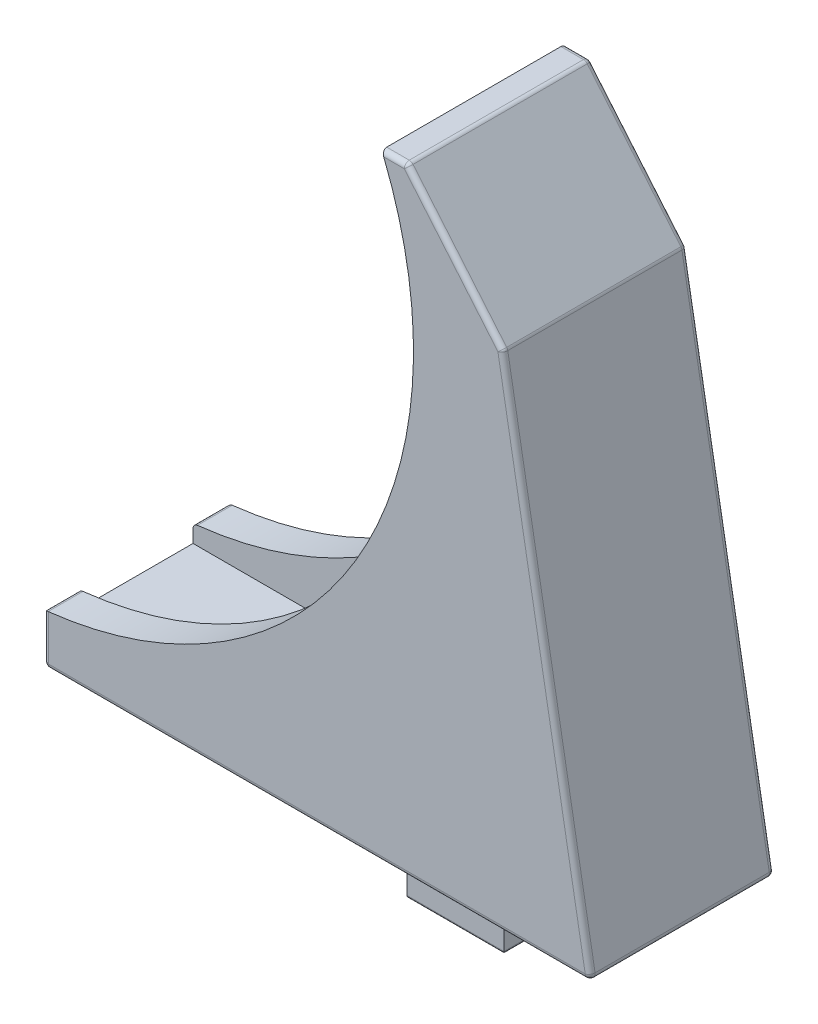
from build123d import *

# Parameters (mm, degrees)
EXTRUDE_1_DEPTH          = 2.3
EXTRUDE_1_DEPTH_BACK     = 2.3
EXTRUDE_2_DEPTH          = 1.4
EXTRUDE_3_DEPTH          = 2
EXTRUDE_3_DEPTH_BACK     = 2
CUT_EXTRUDE_2_DEPTH      = 7.4
CUT_EXTRUDE_3_DEPTH      = 2
CUT_EXTRUDE_3_DEPTH_BACK = 2
FILLET_1_R               = 0.2
FILLET_2_R               = 0.1


with BuildPart() as part:
    # 草图1 → 凸台-拉伸1 (new, two sides: drawn at the far end of the back side and taken through both)
    with BuildSketch(Plane.XY.offset(-EXTRUDE_1_DEPTH_BACK)):
        Polygon((0, 0), (-14.8, 0), (-14.8, 1.3), (0, 1.3), (5.65072033, 1.3), (2.420449835, 19.619774331), (-0.822713256, 23.484825595), (-1.2165133, 23.484825595), (-1.2165133, 24.784825595), (-0.2165133, 24.784825595), (3.640212358, 20.188558937), (7.2, 0), align=None)
    extrude(amount=EXTRUDE_1_DEPTH + EXTRUDE_1_DEPTH_BACK)

    # 草图2 → 凸台-拉伸2 (add)
    with BuildSketch(Plane.XY.offset(2.3)):
        with BuildLine():
            Line((-14.8, 0), (7.2, 0))
            Line((7.2, 0), (3.640212358, 20.188558937))
            Line((3.640212358, 20.188558937), (-0.2165133, 24.784825595))
            Line((-0.2165133, 24.784825595), (-1.2165133, 24.784825595))
            ThreePointArc((-1.2165133, 24.784825595), (-2.266370135, 9.969308294), (-14.8, 2))
            Line((-14.8, 2), (-14.8, 0))
        make_face()
    extrude_2 = extrude(amount=EXTRUDE_2_DEPTH)

    # 镜向1: 凸台-拉伸2 across plane
    add(extrude_2.mirror(Plane.XY))

    # 草图4 → 凸台-拉伸3 (add, two sides: drawn at the far end of the back side and taken through both)
    with BuildSketch(Plane.XY.offset(-EXTRUDE_3_DEPTH_BACK)):
        with BuildLine():
            Line((-1.5, 0), (1.5, 0))
            Line((1.5, 0), (1.5, -0.677124344))
            ThreePointArc((1.5, -0.677124344), (1.780042303, -1.088161527), (1.95, -1.555590279))
            Line((1.95, -1.555590279), (1.95, -2.5))
            Line((1.95, -2.5), (-1.95, -2.5))
            Line((-1.95, -2.5), (-1.95, -1.555590279))
            ThreePointArc((-1.95, -1.555590279), (-1.780042303, -1.088161527), (-1.5, -0.677124344))
            Line((-1.5, -0.677124344), (-1.5, 0))
        make_face()
    extrude(amount=EXTRUDE_3_DEPTH + EXTRUDE_3_DEPTH_BACK)

    # 草图5 → 切除-拉伸2 (cut)
    with BuildSketch(Plane.XY.offset(3.7)):
        with BuildLine():
            Line((-1.2165133, 24.784825595), (-14.8, 2))
            ThreePointArc((-14.8, 2), (-2.266370135, 9.969308294), (-1.2165133, 24.784825595))
        make_face()
    extrude(amount=-CUT_EXTRUDE_2_DEPTH, mode=Mode.SUBTRACT)

    # 草图6 → 切除-拉伸3 (cut, two sides: drawn at the far end of the back side and taken through both)
    with BuildSketch(Plane(origin=(0, 0, 0), x_dir=(0, 0, -1), z_dir=(1, 0, 0)).offset(-CUT_EXTRUDE_3_DEPTH_BACK)):
        with BuildLine():
            Line((1.5, 0), (1.5, -0.677124344))
            ThreePointArc((1.5, -0.677124344), (1.780042303, -1.088161527), (1.95, -1.555590279))
            Line((1.95, -1.555590279), (1.95, -2.5))
            Line((1.95, -2.5), (2, -2.5))
            Line((2, -2.5), (2, 0))
            Line((2, 0), (1.5, 0))
        make_face()
        with BuildLine():
            Line((-1.95, -2.5), (-2, -2.5))
            Line((-2, -2.5), (-2, 0))
            Line((-2, 0), (-1.5, 0))
            Line((-1.5, 0), (-1.5, -0.677124344))
            ThreePointArc((-1.5, -0.677124344), (-1.780042303, -1.088161527), (-1.95, -1.555590279))
            Line((-1.95, -1.555590279), (-1.95, -2.5))
        make_face()
    extrude(amount=CUT_EXTRUDE_3_DEPTH + CUT_EXTRUDE_3_DEPTH_BACK, mode=Mode.SUBTRACT)

    # 圆角1
    fillet_1_edges = [part.edges().sort_by_distance(p)[0] for p in [
        (-14.8, 2, -3),
        (-14.8, 2, 3),
        (-14.8, 1, 3.7),
        (-14.8, 1, -3.7),
        (-0.7165133, 24.784825595, -3.7),
        (-0.7165133, 24.784825595, 3.7),
        (-0.2165133, 24.784825595, 0),
        (1.711849529, 22.486692266, -3.7),
        (1.711849529, 22.486692266, 3.7),
        (3.640212358, 20.188558937, 0),
        (5.420106179, 10.094279468, -3.7),
        (5.420106179, 10.094279468, 3.7),
        (7.2, 0, 0),
        (-3.8, 0, -3.7),
        (-3.8, 0, 3.7),
        (-14.8, 0, 0),
    ]]
    fillet(fillet_1_edges, radius=FILLET_1_R)

    # 圆角2
    fillet_2_edges = [part.edges().sort_by_distance(p)[0] for p in [
        (0, -2.5, -1.95),
        (-1.95, -2.5, 0),
        (0, -2.5, 1.95),
        (1.95, -2.5, 0),
    ]]
    fillet(fillet_2_edges, radius=FILLET_2_R)


solid = part.part
